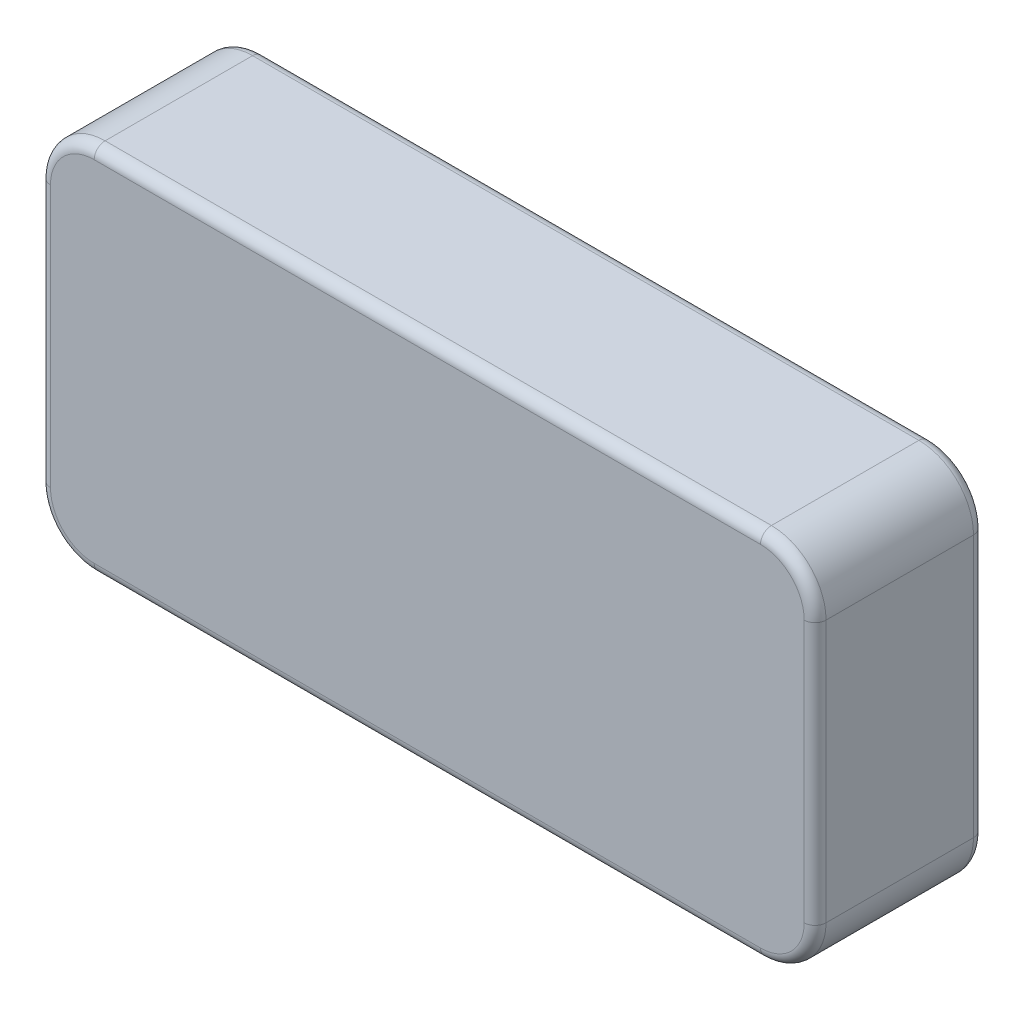
from build123d import *

# Parameters (mm, degrees)
SKETCH1_W           = 71
SKETCH1_H           = 34
BOSS_EXTRUDE1_DEPTH = 15.5
FILLET1_R           = 5
FILLET2_R           = 1


with BuildPart() as part:
    # Sketch1 → Boss-Extrude1 (new body)
    with BuildSketch(Plane.XY):
        Rectangle(SKETCH1_W, SKETCH1_H)
    extrude(amount=BOSS_EXTRUDE1_DEPTH)

    # Fillet1
    fillet1_edges = [part.edges().sort_by_distance(p)[0] for p in [
        (-35.5, 17, 7.75),
        (35.5, 17, 7.75),
        (35.5, -17, 7.75),
        (-35.5, -17, 7.75),
    ]]
    fillet(fillet1_edges, radius=FILLET1_R)

    # Fillet2
    fillet2_edges = [part.edges().sort_by_distance(p)[0] for p in [
        (0, 17, 0),
        (0, 17, 15.5),
        (-35.5, 0, 0),
        (35.5, 0, 0),
        (0, -17, 0),
        (34.035533906, -15.535533906, 0),
        (-34.035533906, 15.535533906, 0),
        (-34.035533906, -15.535533906, 0),
        (34.035533906, 15.535533906, 0),
        (35.5, 0, 15.5),
        (-35.5, 0, 15.5),
        (0, -17, 15.5),
        (34.035533906, -15.535533906, 15.5),
        (-34.035533906, 15.535533906, 15.5),
        (-34.035533906, -15.535533906, 15.5),
        (34.035533906, 15.535533906, 15.5),
    ]]
    fillet(fillet2_edges, radius=FILLET2_R)


solid = part.part
